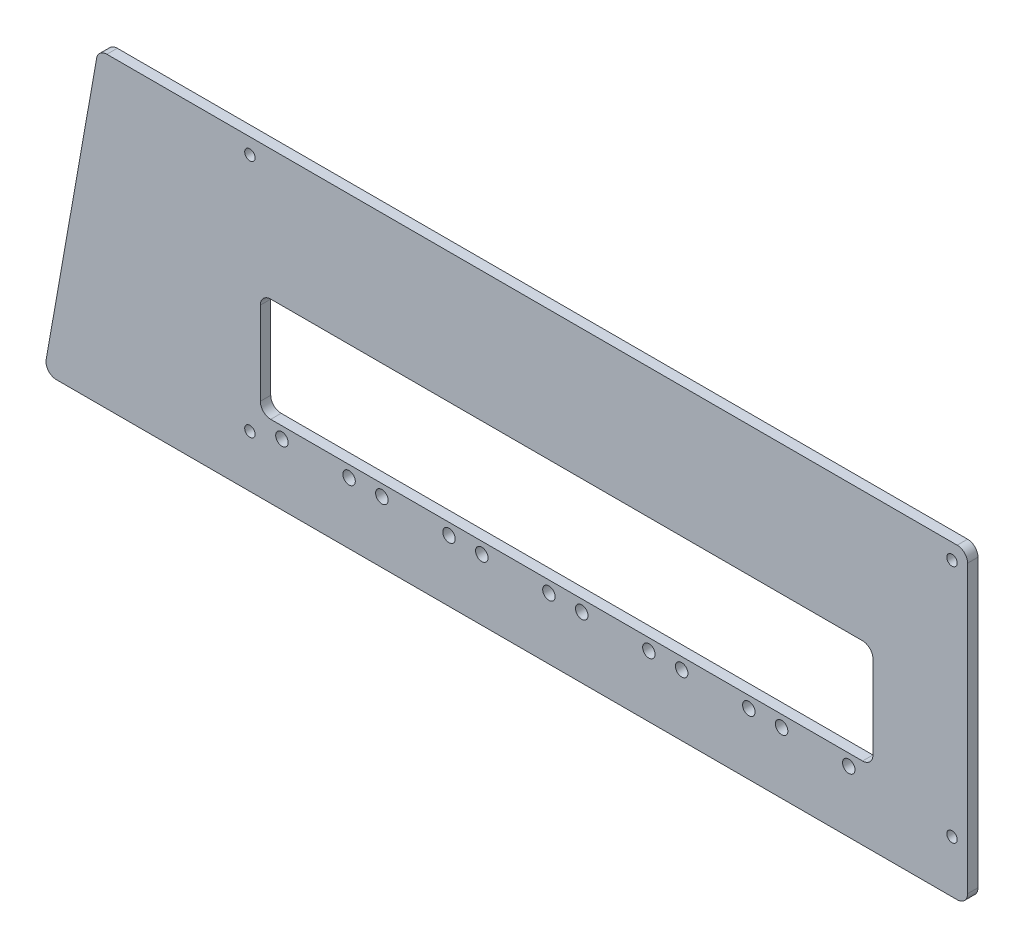
from build123d import *

# Parameters (mm, degrees)
SKETCH2_R           = 5
SKETCH2_R_2         = 6
BOSS_EXTRUDE1_DEPTH = 10


with BuildPart() as part:
    # Sketch2 → Boss-Extrude1 (new body)
    with BuildSketch(Plane.XY):
        with BuildLine():
            Line((-737.317762878, -23.619861577), (127.964701196, -23.619861577))
            ThreePointArc((127.964701196, -23.619861577), (135.035769008, -20.690929389), (137.964701196, -13.619861577))
            Line((137.964701196, -13.619861577), (137.964701196, 261.380138423))
            ThreePointArc((137.964701196, 261.380138423), (135.035769008, 268.451206235), (127.964701196, 271.380138423))
            Line((127.964701196, 271.380138423), (-688.827843183, 271.380138423))
            ThreePointArc((-688.827843183, 271.380138423), (-695.25571928, 269.040582854), (-698.675920713, 263.116620199))
            Line((-698.675920713, 263.116620199), (-747.165840408, -11.883379801))
            ThreePointArc((-747.165840408, -11.883379801), (-744.978207309, -20.047737674), (-737.317762878, -23.619861577))
        make_face()
        with Locations(Location((122.964701196, 256.380138423, 0), (0, 0, 180))):
            Circle(SKETCH2_R, mode=Mode.SUBTRACT)
        with Locations((-520.685298804, 35.380138423)):
            Circle(SKETCH2_R_2, mode=Mode.SUBTRACT)
        with Locations(Location((122.964701196, 26.380138423, 0), (0, 0, 180))):
            Circle(SKETCH2_R, mode=Mode.SUBTRACT)
        with Locations((-551.435298804, 256.380138423)):
            Circle(SKETCH2_R, mode=Mode.SUBTRACT)
        with Locations(Location((-456.185298804, 35.380138423, 0), (0, 0, 180))):
            Circle(SKETCH2_R_2, mode=Mode.SUBTRACT)
        with Locations((-424.685298804, 35.380138423)):
            Circle(SKETCH2_R_2, mode=Mode.SUBTRACT)
        with Locations(Location((-360.185298804, 35.380138423, 0), (0, 0, 180))):
            Circle(SKETCH2_R_2, mode=Mode.SUBTRACT)
        with Locations((-328.685298804, 35.380138423)):
            Circle(SKETCH2_R_2, mode=Mode.SUBTRACT)
        with Locations(Location((-264.185298804, 35.380138423, 0), (0, 0, 180))):
            Circle(SKETCH2_R_2, mode=Mode.SUBTRACT)
        with Locations((-232.685298804, 35.380138423)):
            Circle(SKETCH2_R_2, mode=Mode.SUBTRACT)
        with Locations(Location((-168.185298804, 35.380138423, 0), (0, 0, 180))):
            Circle(SKETCH2_R_2, mode=Mode.SUBTRACT)
        with Locations((-136.685298804, 35.380138423)):
            Circle(SKETCH2_R_2, mode=Mode.SUBTRACT)
        with Locations(Location((-72.185298804, 35.380138423, 0), (0, 0, 180))):
            Circle(SKETCH2_R_2, mode=Mode.SUBTRACT)
        with Locations((-551.435298804, 26.380138423)):
            Circle(SKETCH2_R, mode=Mode.SUBTRACT)
        with Locations((-40.685298804, 35.380138423)):
            Circle(SKETCH2_R_2, mode=Mode.SUBTRACT)
        with Locations(Location((23.814701196, 35.380138423, 0), (0, 0, 180))):
            Circle(SKETCH2_R_2, mode=Mode.SUBTRACT)
        with BuildLine():
            Line((-531.435298804, 46.380138423), (37.064561069, 46.380138423))
            ThreePointArc((37.064561069, 46.380138423), (44.135628881, 49.309070611), (47.064561069, 56.380138423))
            Line((47.064561069, 56.380138423), (47.064561069, 136.380138423))
            ThreePointArc((47.064561069, 136.380138423), (44.135628881, 143.451206235), (37.064561069, 146.380138423))
            Line((37.064561069, 146.380138423), (-531.435298804, 146.380138423))
            ThreePointArc((-531.435298804, 146.380138423), (-538.506366616, 143.451206235), (-541.435298804, 136.380138423))
            Line((-541.435298804, 136.380138423), (-541.435298804, 56.380138423))
            ThreePointArc((-541.435298804, 56.380138423), (-538.506366616, 49.309070611), (-531.435298804, 46.380138423))
        make_face(mode=Mode.SUBTRACT)
    extrude(amount=BOSS_EXTRUDE1_DEPTH)


solid = part.part
